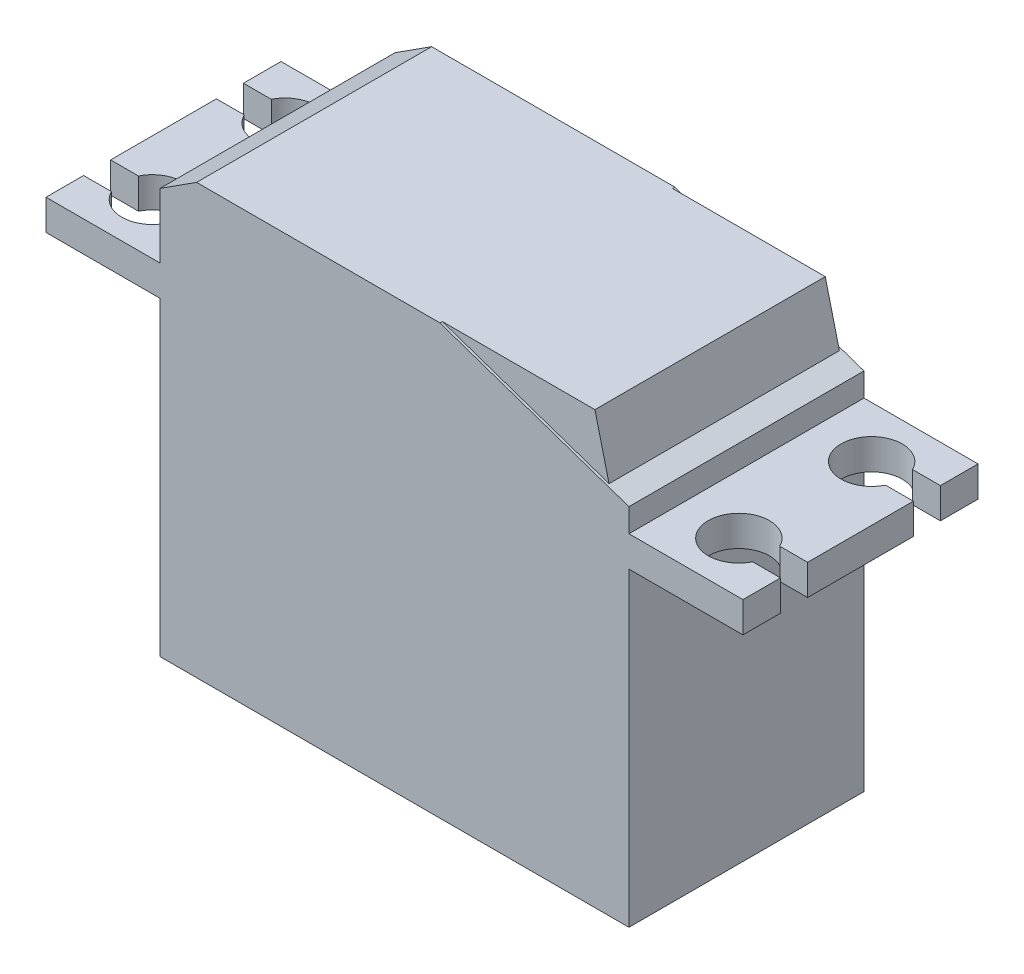
from build123d import *

# Parameters (mm, degrees)
SKETCH1_W           = 39.9
SKETCH1_H           = 20
BOSS_EXTRUDE1_DEPTH = 18.25
SKETCH2_W           = 20
SKETCH2_H           = 2.6
BOSS_EXTRUDE2_DEPTH = 9.7
CUT_EXTRUDE1_DEPTH  = 41.15202361
BOSS_EXTRUDE3_DEPTH = 19.8
CUT_EXTRUDE2_REACH  = 44.663
CUT_EXTRUDE4_DEPTH  = 0.2
CUT_EXTRUDE5_REACH  = 42.152


with BuildPart() as part:
    # Sketch1 → Boss-Extrude1 (new, symmetric)
    with BuildSketch(Plane(origin=(0, 0, 0), x_dir=(1, 0, 0), z_dir=(0, 1, 0))):
        Rectangle(SKETCH1_W, SKETCH1_H)
    extrude(amount=BOSS_EXTRUDE1_DEPTH, both=True)

    # Sketch2 → Boss-Extrude2 (add)
    with BuildSketch(Plane(origin=(19.95, 0, 0), x_dir=(0, 0, -1), z_dir=(1, 0, 0))):
        with Locations((0, 9.45)):
            Rectangle(SKETCH2_W, SKETCH2_H)
    boss_extrude2 = extrude(amount=BOSS_EXTRUDE2_DEPTH)

    # Sketch3 → Cut-Extrude1 (cut, through all)
    with BuildSketch(Plane.XY.offset(10)):
        Polygon((19.95, 12.75), (3.864292058, 18.25), (19.95, 18.25), align=None)
    extrude(amount=-CUT_EXTRUDE1_DEPTH, mode=Mode.SUBTRACT)

    # Sketch5 → Boss-Extrude3 (add)
    with BuildSketch(Plane.XY.offset(10)):
        Polygon((3.864292058, 18.25), (16.853835423, 18.25), (18.057563772, 13.397058824), align=None)
    extrude(amount=-BOSS_EXTRUDE3_DEPTH)

    # Sketch7 → Cut-Extrude2 (cut, up to next)
    with BuildSketch(Plane(origin=(0, 10.75, 0), x_dir=(1, 0, 0), z_dir=(0, 1, 0)), mode=Mode.PRIVATE) as cut_extrude2_sk1:
        with BuildLine():
            Line((29.65, 6.8), (27.281844763, 6.8))
            ThreePointArc((27.281844763, 6.8), (22.35, 5.65), (27.281844763, 4.5))
            Line((27.281844763, 4.5), (29.65, 4.5))
            Line((29.65, 4.5), (29.65, 6.8))
        make_face()
    cut_extrude2_tool1 = extrude(cut_extrude2_sk1.sketch, amount=-CUT_EXTRUDE2_REACH, mode=Mode.PRIVATE) & part.part
    # Sketch7 → Cut-Extrude2 (cut, up to next)
    with BuildSketch(Plane(origin=(0, 10.75, 0), x_dir=(1, 0, 0), z_dir=(0, 1, 0)), mode=Mode.PRIVATE) as cut_extrude2_sk2:
        with BuildLine():
            Line((29.65, -6.8), (27.281844763, -6.8))
            ThreePointArc((27.281844763, -6.8), (22.35, -5.65), (27.281844763, -4.5))
            Line((27.281844763, -4.5), (29.65, -4.5))
            Line((29.65, -4.5), (29.65, -6.8))
        make_face()
    cut_extrude2_tool2 = extrude(cut_extrude2_sk2.sketch, amount=-CUT_EXTRUDE2_REACH, mode=Mode.PRIVATE) & part.part
    cut_extrude2_1 = cut_extrude2_tool1.solids().sort_by_distance((25.640431, 10.75, -5.65))[0]
    add(cut_extrude2_1, mode=Mode.SUBTRACT)
    cut_extrude2_2 = cut_extrude2_tool2.solids().sort_by_distance((25.640431, 10.75, 5.65))[0]
    add(cut_extrude2_2, mode=Mode.SUBTRACT)
    cut_extrude2 = cut_extrude2_1 + cut_extrude2_2  # Cut-Extrude2 as one shape, for the pattern or mirror that repeats it

    # Sketch9 → Cut-Extrude4 (cut)
    with BuildSketch(Plane.XY.offset(10)):
        Polygon((16.853835423, 18.25), (3.864292058, 18.25), (18.057563772, 13.397058824), align=None)
    extrude(amount=-CUT_EXTRUDE4_DEPTH, mode=Mode.SUBTRACT)

    # Sketch10 → Cut-Extrude5 (cut, up to next)
    with BuildSketch(Plane(origin=(0, 0, -10), x_dir=(-1, 0, 0), z_dir=(0, 0, -1)), mode=Mode.PRIVATE) as cut_extrude5_sk1:
        Polygon((16.837123517, 18.25), (19.95, 16.25), (19.95, 18.25), align=None)
    cut_extrude5_tool1 = extrude(cut_extrude5_sk1.sketch, amount=-CUT_EXTRUDE5_REACH, mode=Mode.PRIVATE) & part.part
    add(cut_extrude5_tool1.solids().sort_by_distance((-18.912375, 17.583333, -10))[0], mode=Mode.SUBTRACT)

    # Mirror1: Boss-Extrude2, Cut-Extrude2 across plane
    add(boss_extrude2.mirror(Plane(origin=(0, 0, 0), x_dir=(0, 0, 1), z_dir=(1, 0, 0))))
    add(cut_extrude2.mirror(Plane(origin=(0, 0, 0), x_dir=(0, 0, 1), z_dir=(1, 0, 0))), mode=Mode.SUBTRACT)


solid = part.part
